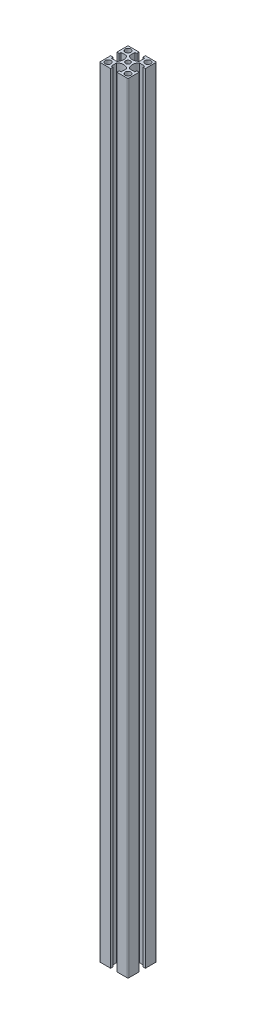
from build123d import *

# Parameters (mm, degrees)
SKETCH_1_R      = 2.5
SKETCH_1_R_2    = 3
EXTRUDE_1_DEPTH = 820
FILLET_1_R      = 1


with BuildPart() as part:
    # 草圖1 → 填料-伸長1 (new body)
    with BuildSketch(Plane(origin=(0, 0, 0), x_dir=(1, 0, 0), z_dir=(0, 1, 0))):
        with BuildLine():
            Line((5.25, 6.643928679), (5.25, 12.5))
            Line((5.25, 12.5), (3.25, 12.5))
            Line((3.25, 12.5), (3.25, 15))
            Line((3.25, 15), (15, 15))
            Line((15, 15), (15, 3.25))
            Line((15, 3.25), (12.5, 3.25))
            Line((12.5, 3.25), (12.5, 5.25))
            Line((12.5, 5.25), (6.643928679, 5.25))
            ThreePointArc((6.643928679, 5.25), (4.5, 0), (6.643928679, -5.25))
            Line((6.643928679, -5.25), (12.5, -5.25))
            Line((12.5, -5.25), (12.5, -3.25))
            Line((12.5, -3.25), (15, -3.25))
            Line((15, -3.25), (15, -15))
            Line((15, -15), (3.25, -15))
            Line((3.25, -15), (3.25, -12.5))
            Line((3.25, -12.5), (5.25, -12.5))
            Line((5.25, -12.5), (5.25, -6.643928679))
            ThreePointArc((5.25, -6.643928679), (0, -4.5), (-5.25, -6.643928679))
            Line((-5.25, -6.643928679), (-5.25, -12.5))
            Line((-5.25, -12.5), (-3.25, -12.5))
            Line((-3.25, -12.5), (-3.25, -15))
            Line((-3.25, -15), (-15, -15))
            Line((-15, -15), (-15, -3.25))
            Line((-15, -3.25), (-12.5, -3.25))
            Line((-12.5, -3.25), (-12.5, -5.25))
            Line((-12.5, -5.25), (-6.643928679, -5.25))
            ThreePointArc((-6.643928679, -5.25), (-4.5, 0), (-6.643928679, 5.25))
            Line((-6.643928679, 5.25), (-12.5, 5.25))
            Line((-12.5, 5.25), (-12.5, 3.25))
            Line((-12.5, 3.25), (-15, 3.25))
            Line((-15, 3.25), (-15, 15))
            Line((-15, 15), (-3.25, 15))
            Line((-3.25, 15), (-3.25, 12.5))
            Line((-3.25, 12.5), (-5.25, 12.5))
            Line((-5.25, 12.5), (-5.25, 6.643928679))
            ThreePointArc((-5.25, 6.643928679), (0, 4.5), (5.25, 6.643928679))
        make_face()
        with Locations(Location((0, 0, 0), (0, 0, 90))):
            Circle(SKETCH_1_R, mode=Mode.SUBTRACT)
        with Locations(Location((10.47348217, 10.47348217, 0), (0, 0, 90))):
            Circle(SKETCH_1_R_2, mode=Mode.SUBTRACT)
        with Locations(Location((-10.47348217, 10.47348217, 0), (0, 0, 90))):
            Circle(SKETCH_1_R_2, mode=Mode.SUBTRACT)
        with Locations(Location((-10.47348217, -10.47348217, 0), (0, 0, 90))):
            Circle(SKETCH_1_R_2, mode=Mode.SUBTRACT)
        with Locations(Location((10.47348217, -10.47348217, 0), (0, 0, 90))):
            Circle(SKETCH_1_R_2, mode=Mode.SUBTRACT)
    extrude(amount=EXTRUDE_1_DEPTH)

    # 圓角1
    fillet_1_edges = [part.edges().sort_by_distance(p)[0] for p in [
        (-15, 410, -15),
        (15, 410, -15),
        (15, 410, 15),
        (-15, 410, 15),
    ]]
    fillet(fillet_1_edges, radius=FILLET_1_R)


solid = part.part
